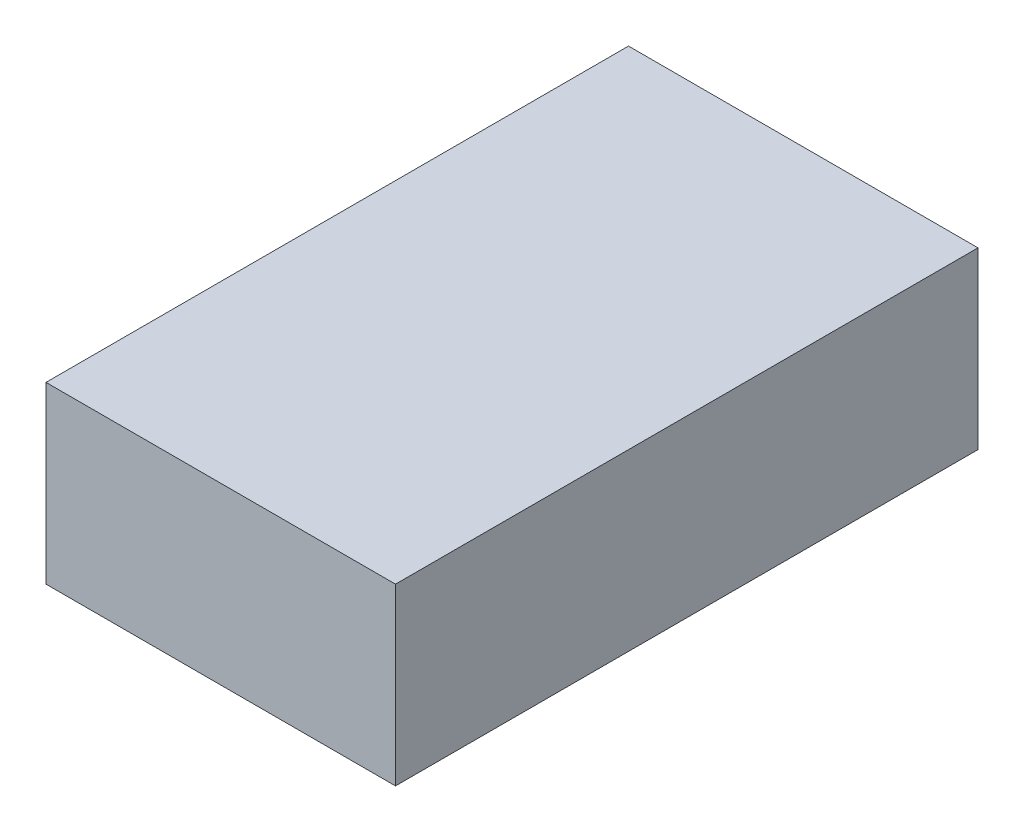
from build123d import *

# Parameters (mm, degrees)
CROQUIS1_W              = 6
CROQUIS1_H              = 3
SALIENTE_EXTRUIR1_DEPTH = 10


with BuildPart() as part:
    # Croquis1 → Saliente-Extruir1 (new body)
    with BuildSketch(Plane.XY):
        with Locations((-7.081967213, 0.295081967)):
            Rectangle(CROQUIS1_W, CROQUIS1_H)
    extrude(amount=SALIENTE_EXTRUIR1_DEPTH)


solid = part.part
